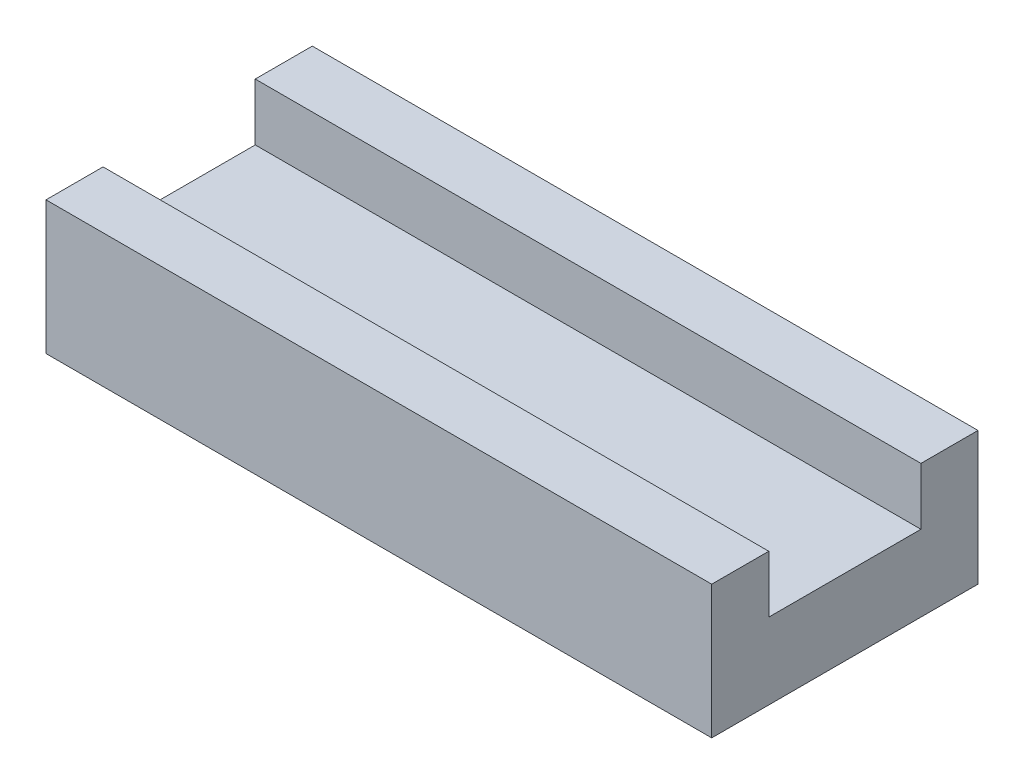
from build123d import *

# Parameters (mm, degrees)
BOSS_EXTRUDE1_DEPTH = 35


with BuildPart() as part:
    # Sketch1 → Boss-Extrude1 (new body)
    with BuildSketch(Plane(origin=(0, 0, 0), x_dir=(0, 0, -1), z_dir=(1, 0, 0))):
        Polygon((-7, 2), (-7, 5), (-4, 5), (-4, 2), (4, 2), (4, 5), (7, 5), (7, 2), (7, -2), (-7, -2), align=None)
    extrude(amount=-BOSS_EXTRUDE1_DEPTH)


solid = part.part
